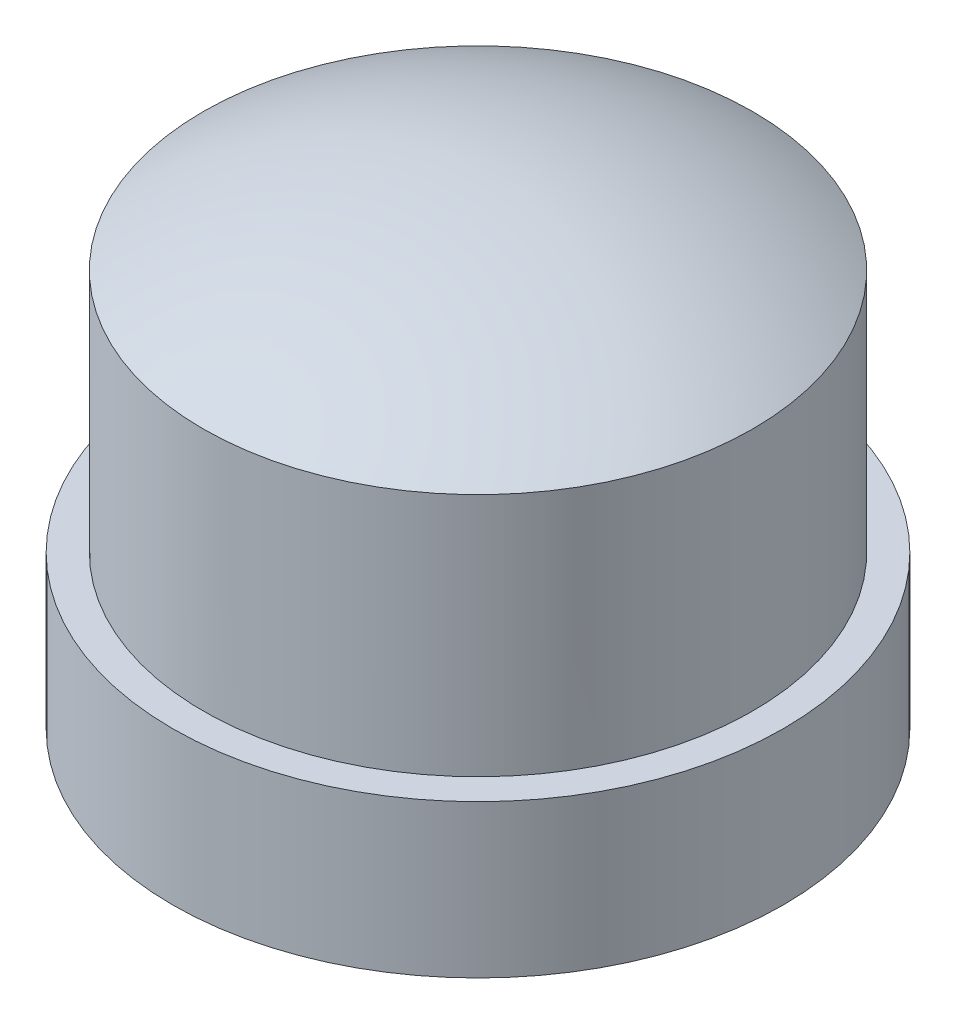
from build123d import *

# Parameters (mm, degrees)
SKETCH1_R           = 10
BOSS_EXTRUDE1_DEPTH = 5


with BuildPart() as part:
    # Sketch1 → Boss-Extrude1 (new body)
    with BuildSketch(Plane(origin=(0, 0, 0), x_dir=(1, 0, 0), z_dir=(0, 1, 0))):
        with Locations(Location((0, 0, 0), (0, 0, 270))):
            Circle(SKETCH1_R)
    extrude(amount=BOSS_EXTRUDE1_DEPTH)

    # Sketch2 → Revolve1 (revolve)
    with BuildSketch(Plane(origin=(0, 0, 0), x_dir=(0, 0, -1), z_dir=(1, 0, 0)), mode=Mode.PRIVATE) as revolve1_sk:
        with BuildLine():
            Line((-9, 13), (-9, 5))
            Line((-9, 5), (0, 5))
            Line((0, 5), (0, 15.5))
            ThreePointArc((0, 15.5), (-4.670385423, 14.863387523), (-9, 13))
        make_face()
    revolve(revolve1_sk.sketch.rotate(Axis((0, 5, 0), (0, 1, 0)), 180), axis=Axis((0, 5, 0), (0, 1, 0)))


solid = part.part
